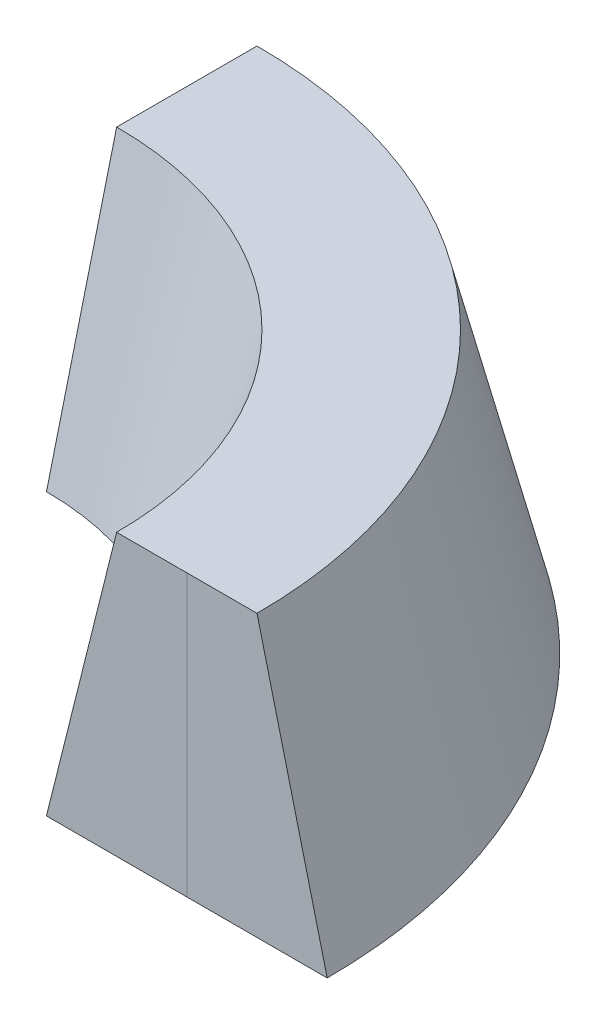
from build123d import *

# Parameters (mm, degrees)
REVOLVE1_ANGLE = 90


with BuildPart() as part:
    # Sketch1 → Revolve1 (revolve)
    with BuildSketch(Plane.XY):
        Polygon((4000, 0), (8000, 0), (7000, 4000), (5000, 4000), align=None)
    revolve(axis=Axis((0, 0, 0), (0, 1, 0)), revolution_arc=REVOLVE1_ANGLE)


solid = part.part
